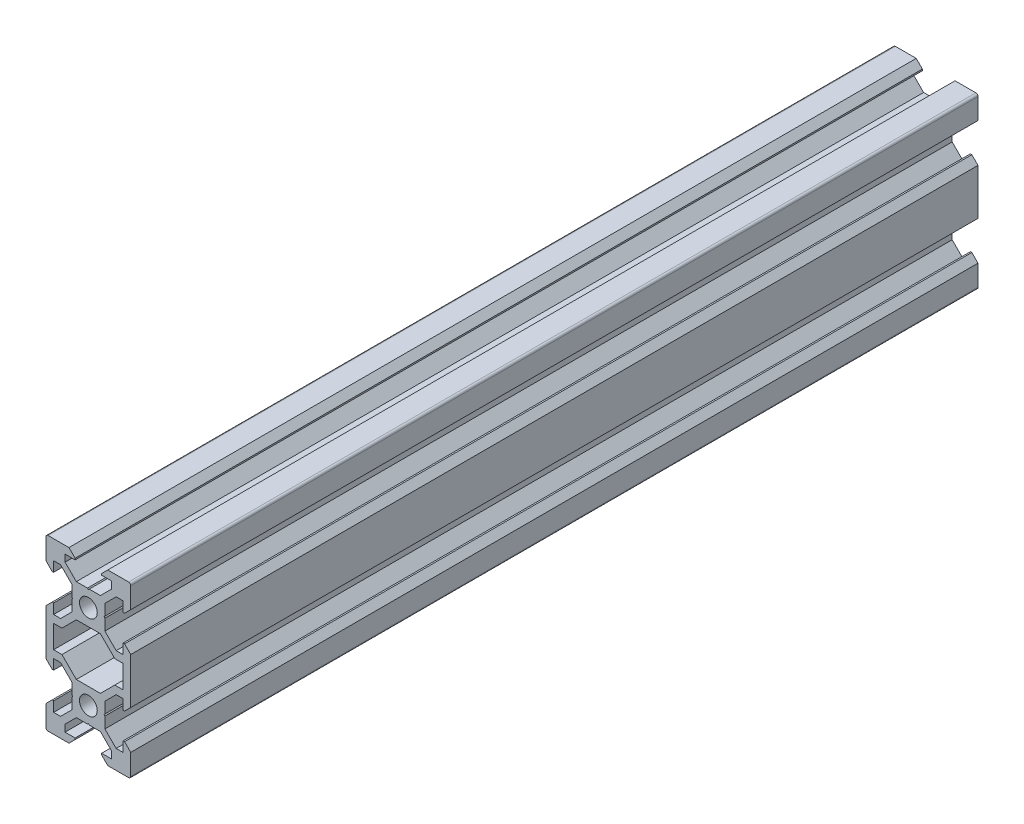
from build123d import *

# Parameters (mm, degrees)
SKETCH2_R           = 2.1
BOSS_EXTRUDE1_DEPTH = 200


with BuildPart() as part:
    # Sketch2 → Boss-Extrude1 (new body)
    with BuildSketch(Plane.XY):
        with BuildLine():
            Line((4.006804208, 10.145798499), (3.796804208, 10.355798499))
            Line((3.796804208, 10.355798499), (4.006804208, 10.565798499))
            Line((4.006804208, 10.565798499), (4.006804208, 13.195138327))
            Line((4.006804208, 13.195138327), (6.66746438, 15.855798499))
            Line((6.66746438, 15.855798499), (8.306804208, 15.855798499))
            Line((8.306804208, 15.855798499), (8.306804208, 13.480798499))
            Line((8.306804208, 13.480798499), (8.651804208, 13.480798499))
            Line((8.651804208, 13.480798499), (10.106804208, 14.935798499))
            Line((10.106804208, 14.935798499), (10.106804208, 19.855798499))
            ThreePointArc((10.106804208, 19.855798499), (9.960357598, 20.209351889), (9.606804208, 20.355798499))
            Line((9.606804208, 20.355798499), (4.686804208, 20.355798499))
            Line((4.686804208, 20.355798499), (3.231804208, 18.900798499))
            Line((3.231804208, 18.900798499), (3.231804208, 18.555798499))
            Line((3.231804208, 18.555798499), (5.606804208, 18.555798499))
            Line((5.606804208, 18.555798499), (5.606804208, 16.91645867))
            Line((5.606804208, 16.91645867), (2.946144036, 14.255798499))
            Line((2.946144036, 14.255798499), (0.316804208, 14.255798499))
            Line((0.316804208, 14.255798499), (0.106804208, 14.045798499))
            Line((0.106804208, 14.045798499), (-0.103195792, 14.255798499))
            Line((-0.103195792, 14.255798499), (-2.73253562, 14.255798499))
            Line((-2.73253562, 14.255798499), (-5.393195792, 16.91645867))
            Line((-5.393195792, 16.91645867), (-5.393195792, 18.555798499))
            Line((-5.393195792, 18.555798499), (-3.018195792, 18.555798499))
            Line((-3.018195792, 18.555798499), (-3.018195792, 18.900798499))
            Line((-3.018195792, 18.900798499), (-4.473195792, 20.355798499))
            Line((-4.473195792, 20.355798499), (-9.393195792, 20.355798499))
            ThreePointArc((-9.393195792, 20.355798499), (-9.746749183, 20.209351889), (-9.893195792, 19.855798499))
            Line((-9.893195792, 19.855798499), (-9.893195792, 14.935798499))
            Line((-9.893195792, 14.935798499), (-8.438195792, 13.480798499))
            Line((-8.438195792, 13.480798499), (-8.093195792, 13.480798499))
            Line((-8.093195792, 13.480798499), (-8.093195792, 15.855798499))
            Line((-8.093195792, 15.855798499), (-6.453855964, 15.855798499))
            Line((-6.453855964, 15.855798499), (-3.793195792, 13.195138327))
            Line((-3.793195792, 13.195138327), (-3.793195792, 10.565798499))
            Line((-3.793195792, 10.565798499), (-3.583195792, 10.355798499))
            Line((-3.583195792, 10.355798499), (-3.793195792, 10.145798499))
            Line((-3.793195792, 10.145798499), (-3.793195792, 7.51645867))
            Line((-3.793195792, 7.51645867), (-6.453855964, 4.855798499))
            Line((-6.453855964, 4.855798499), (-8.093195792, 4.855798499))
            Line((-8.093195792, 4.855798499), (-8.093195792, 7.230798499))
            Line((-8.093195792, 7.230798499), (-8.438195792, 7.230798499))
            Line((-8.438195792, 7.230798499), (-9.893195792, 5.775798499))
            Line((-9.893195792, 5.775798499), (-9.893195792, -5.064201501))
            Line((-9.893195792, -5.064201501), (-8.438195792, -6.519201501))
            Line((-8.438195792, -6.519201501), (-8.093195792, -6.519201501))
            Line((-8.093195792, -6.519201501), (-8.093195792, -4.144201501))
            Line((-8.093195792, -4.144201501), (-6.453855964, -4.144201501))
            Line((-6.453855964, -4.144201501), (-3.793195792, -6.804861673))
            Line((-3.793195792, -6.804861673), (-3.793195792, -9.434201501))
            Line((-3.793195792, -9.434201501), (-3.583195792, -9.644201501))
            Line((-3.583195792, -9.644201501), (-3.793195792, -9.854201501))
            Line((-3.793195792, -9.854201501), (-3.793195792, -12.48354133))
            Line((-3.793195792, -12.48354133), (-6.453855964, -15.144201501))
            Line((-6.453855964, -15.144201501), (-8.093195792, -15.144201501))
            Line((-8.093195792, -15.144201501), (-8.093195792, -12.769201501))
            Line((-8.093195792, -12.769201501), (-8.438195792, -12.769201501))
            Line((-8.438195792, -12.769201501), (-9.893195792, -14.224201501))
            Line((-9.893195792, -14.224201501), (-9.893195792, -19.144201501))
            ThreePointArc((-9.893195792, -19.144201501), (-9.746749183, -19.497754892), (-9.393195792, -19.644201501))
            Line((-9.393195792, -19.644201501), (-4.473195792, -19.644201501))
            Line((-4.473195792, -19.644201501), (-3.018195792, -18.189201501))
            Line((-3.018195792, -18.189201501), (-3.018195792, -17.844201501))
            Line((-3.018195792, -17.844201501), (-5.393195792, -17.844201501))
            Line((-5.393195792, -17.844201501), (-5.393195792, -16.204861673))
            Line((-5.393195792, -16.204861673), (-2.73253562, -13.544201501))
            Line((-2.73253562, -13.544201501), (-0.103195792, -13.544201501))
            Line((-0.103195792, -13.544201501), (0.106804208, -13.334201501))
            Line((0.106804208, -13.334201501), (0.316804208, -13.544201501))
            Line((0.316804208, -13.544201501), (2.946144036, -13.544201501))
            Line((2.946144036, -13.544201501), (5.606804208, -16.204861673))
            Line((5.606804208, -16.204861673), (5.606804208, -17.844201501))
            Line((5.606804208, -17.844201501), (3.231804208, -17.844201501))
            Line((3.231804208, -17.844201501), (3.231804208, -18.189201501))
            Line((3.231804208, -18.189201501), (4.686804208, -19.644201501))
            Line((4.686804208, -19.644201501), (9.606804208, -19.644201501))
            ThreePointArc((9.606804208, -19.644201501), (9.960357598, -19.497754892), (10.106804208, -19.144201501))
            Line((10.106804208, -19.144201501), (10.106804208, -14.224201501))
            Line((10.106804208, -14.224201501), (8.651804208, -12.769201501))
            Line((8.651804208, -12.769201501), (8.306804208, -12.769201501))
            Line((8.306804208, -12.769201501), (8.306804208, -15.144201501))
            Line((8.306804208, -15.144201501), (6.66746438, -15.144201501))
            Line((6.66746438, -15.144201501), (4.006804208, -12.48354133))
            Line((4.006804208, -12.48354133), (4.006804208, -9.854201501))
            Line((4.006804208, -9.854201501), (3.796804208, -9.644201501))
            Line((3.796804208, -9.644201501), (4.006804208, -9.434201501))
            Line((4.006804208, -9.434201501), (4.006804208, -6.804861673))
            Line((4.006804208, -6.804861673), (6.66746438, -4.144201501))
            Line((6.66746438, -4.144201501), (8.306804208, -4.144201501))
            Line((8.306804208, -4.144201501), (8.306804208, -6.519201501))
            Line((8.306804208, -6.519201501), (8.651804208, -6.519201501))
            Line((8.651804208, -6.519201501), (10.106804208, -5.064201501))
            Line((10.106804208, -5.064201501), (10.106804208, 5.775798499))
            Line((10.106804208, 5.775798499), (8.651804208, 7.230798499))
            Line((8.651804208, 7.230798499), (8.306804208, 7.230798499))
            Line((8.306804208, 7.230798499), (8.306804208, 4.855798499))
            Line((8.306804208, 4.855798499), (6.66746438, 4.855798499))
            Line((6.66746438, 4.855798499), (4.006804208, 7.51645867))
            Line((4.006804208, 7.51645867), (4.006804208, 10.145798499))
        make_face()
        with Locations((0.106804208, -9.644201501)):
            Circle(SKETCH2_R, mode=Mode.SUBTRACT)
        with Locations((0.106804208, 10.355798499)):
            Circle(SKETCH2_R, mode=Mode.SUBTRACT)
        Polygon((-6.13253562, -2.344201501), (-2.73253562, -5.744201501), (2.946144036, -5.744201501), (6.346144036, -2.344201501), (8.306804208, -2.344201501), (8.306804208, 3.055798499), (6.346144036, 3.055798499), (2.946144036, 6.455798499), (-2.73253562, 6.455798499), (-6.13253562, 3.055798499), (-8.093195792, 3.055798499), (-8.093195792, -2.344201501), align=None, mode=Mode.SUBTRACT)
    extrude(amount=BOSS_EXTRUDE1_DEPTH)


solid = part.part
